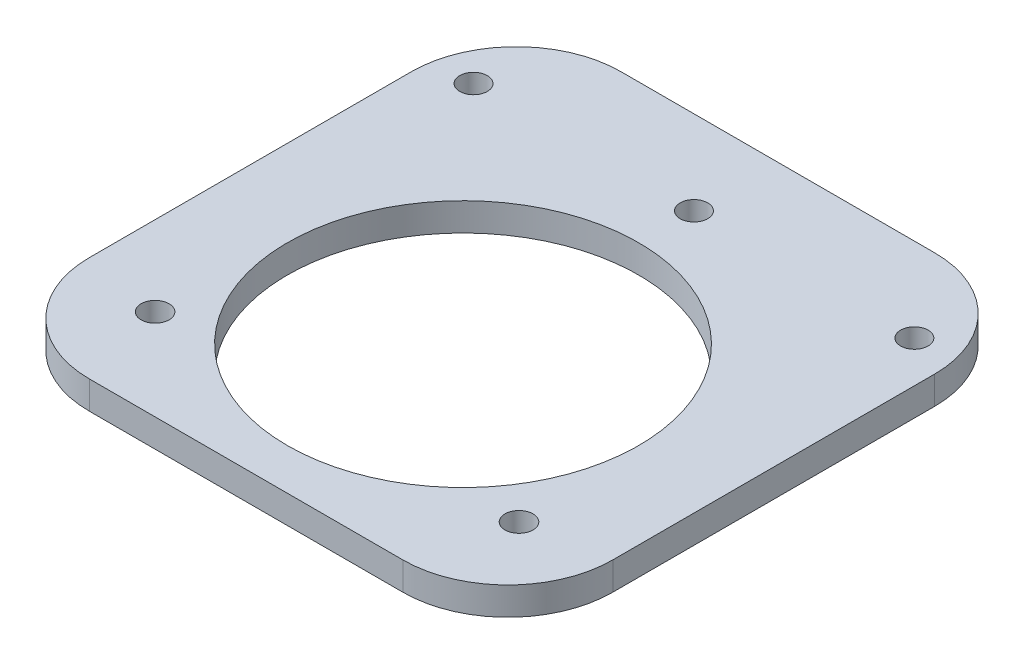
from build123d import *

# Parameters (mm, degrees)
SKETCH2_W                 = 95
SKETCH2_H                 = 96.52
BOSS_EXTRUDE3_DEPTH       = 5.08
SKETCH3_R                 = 31.879999994
CUT_EXTRUDE1_DEPTH        = 78.447905072
M6X1_0_TAPPED_HOLE1_D     = 5
M6X1_0_TAPPED_HOLE1_DEPTH = 5.08
M6X1_0_TAPPED_HOLE1_TIP   = 1.502151548
SKETCH7_R                 = 2.54
CUT_EXTRUDE2_DEPTH        = 7.62
FILLET1_R                 = 19.05


with BuildPart() as part:
    # Sketch2 → Boss-Extrude3 (new body)
    with BuildSketch(Plane(origin=(0, 0, 0), x_dir=(1, 0, 0), z_dir=(0, 1, 0))):
        with Locations((0, -12.7)):
            Rectangle(SKETCH2_W, SKETCH2_H)
    extrude(amount=BOSS_EXTRUDE3_DEPTH)

    # Sketch3 → Cut-Extrude1 (cut, through all)
    with BuildSketch(Plane(origin=(0, 5.08, 0), x_dir=(1, 0, 0), z_dir=(0, 1, 0))):
        with Locations(Location((0, -21.59, 0), (0, 0, 270))):
            Circle(SKETCH3_R)
    extrude(amount=-CUT_EXTRUDE1_DEPTH, mode=Mode.SUBTRACT)

    # M6x1.0 Tapped Hole1
    with Locations(Plane(origin=(0, 5.08, 0), x_dir=(1, 0, 0), z_dir=(0, 1, 0))):
        with Locations((-40, 20.32), (40, 20.32), (0, 20.32)):
            Hole(M6X1_0_TAPPED_HOLE1_D / 2, depth=M6X1_0_TAPPED_HOLE1_DEPTH)
            with Locations((0, 0, -(M6X1_0_TAPPED_HOLE1_DEPTH + M6X1_0_TAPPED_HOLE1_TIP / 2))):  # 118° drill point
                Cone(0, M6X1_0_TAPPED_HOLE1_D / 2, M6X1_0_TAPPED_HOLE1_TIP, mode=Mode.SUBTRACT)

    # Sketch7 → Cut-Extrude2 (cut)
    with BuildSketch(Plane(origin=(0, 5.08, 0), x_dir=(1, 0, 0), z_dir=(0, 1, 0))):
        with Locations(Location((-33.02, -44.45, 0), (0, 0, 270))):
            Circle(SKETCH7_R)
        with Locations(Location((33.02, -44.45, 0), (0, 0, 270))):
            Circle(SKETCH7_R)
    extrude(amount=-CUT_EXTRUDE2_DEPTH, mode=Mode.SUBTRACT)

    # Fillet1
    fillet1_edges = [part.edges().sort_by_distance(p)[0] for p in [
        (47.5, 2.54, -35.56),
        (47.5, 2.54, 60.96),
        (-47.5, 2.54, 60.96),
        (-47.5, 2.54, -35.56),
    ]]
    fillet(fillet1_edges, radius=FILLET1_R)


solid = part.part
